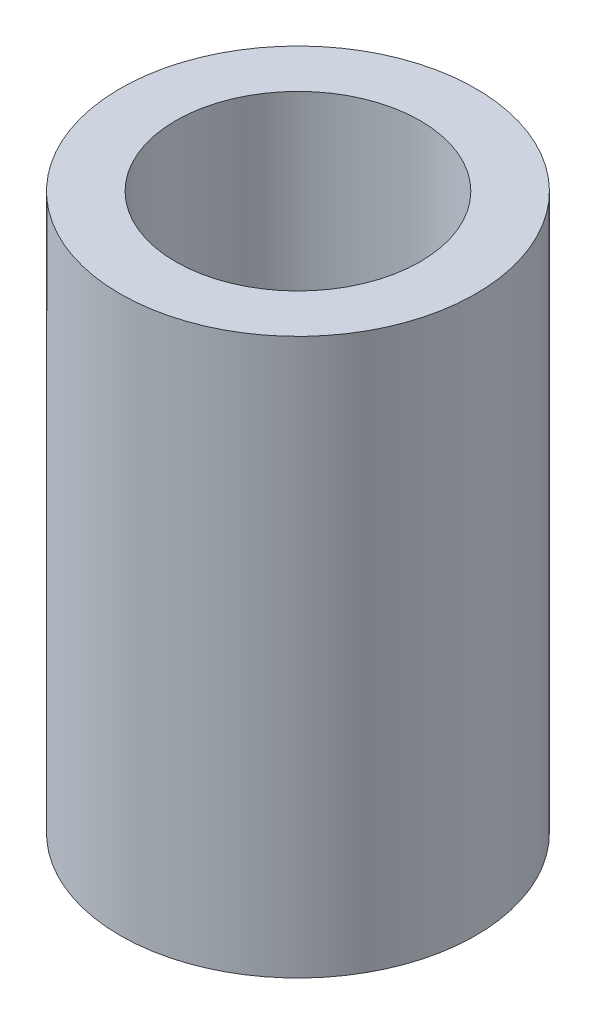
from build123d import *

# Parameters (mm, degrees)
SKETCH1_R           = 1.6
SKETCH1_R_2         = 1.1
BOSS_EXTRUDE1_DEPTH = 5


with BuildPart() as part:
    # Sketch1 → Boss-Extrude1 (new body)
    with BuildSketch(Plane(origin=(0, 0, 0), x_dir=(1, 0, 0), z_dir=(0, 1, 0))):
        with Locations(Location((0, 0, 0), (0, 0, 270))):
            Circle(SKETCH1_R)
        with Locations(Location((0, 0, 0), (0, 0, 270))):
            Circle(SKETCH1_R_2, mode=Mode.SUBTRACT)
    extrude(amount=BOSS_EXTRUDE1_DEPTH)


solid = part.part
